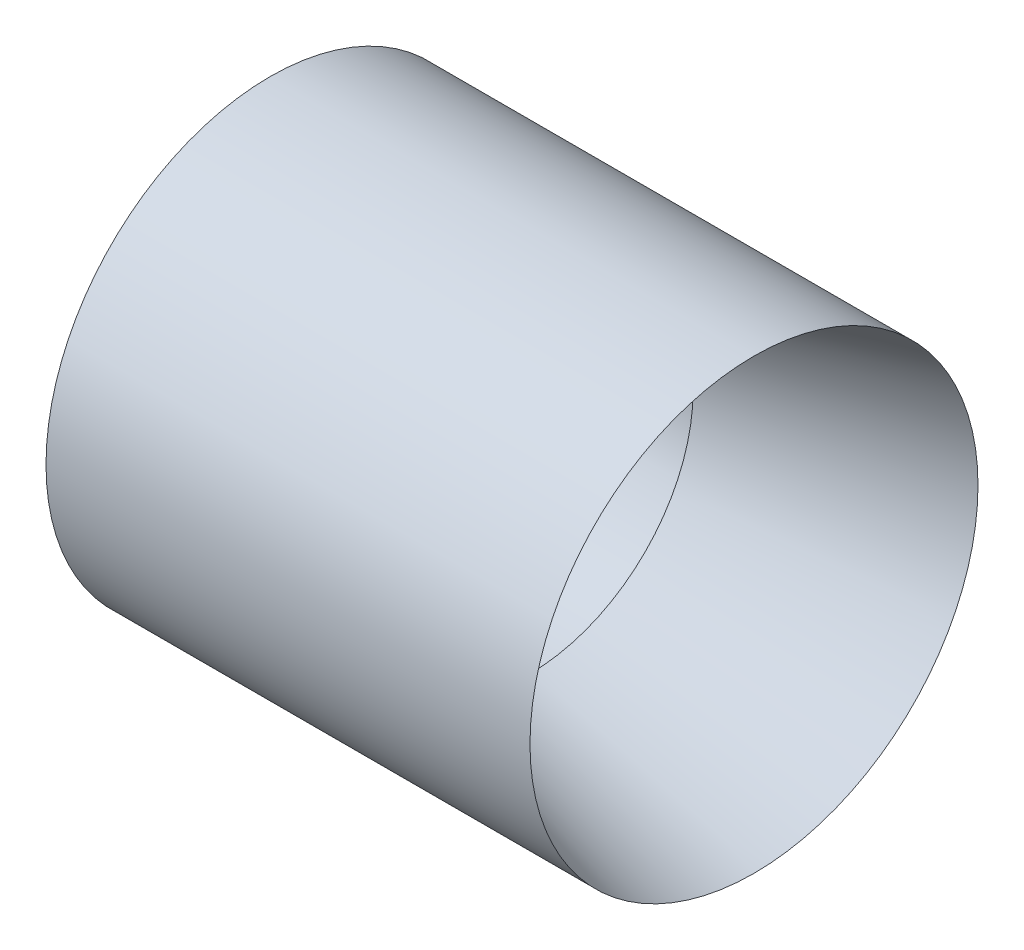
from build123d import *


with BuildPart() as part:
    # Sketch1 → Revolve1 (revolve)
    with BuildSketch(Plane.XY, mode=Mode.PRIVATE) as revolve1_sk:
        Polygon((160.657513694, 26.05), (216.937128562, 26.05), (190.812772909, 19.05), (170.654549742, 19.05), align=None)
    revolve(revolve1_sk.sketch.rotate(Axis((0, 0, 0), (1, 0, 0)), 90), axis=Axis((0, 0, 0), (1, 0, 0)))


solid = part.part
